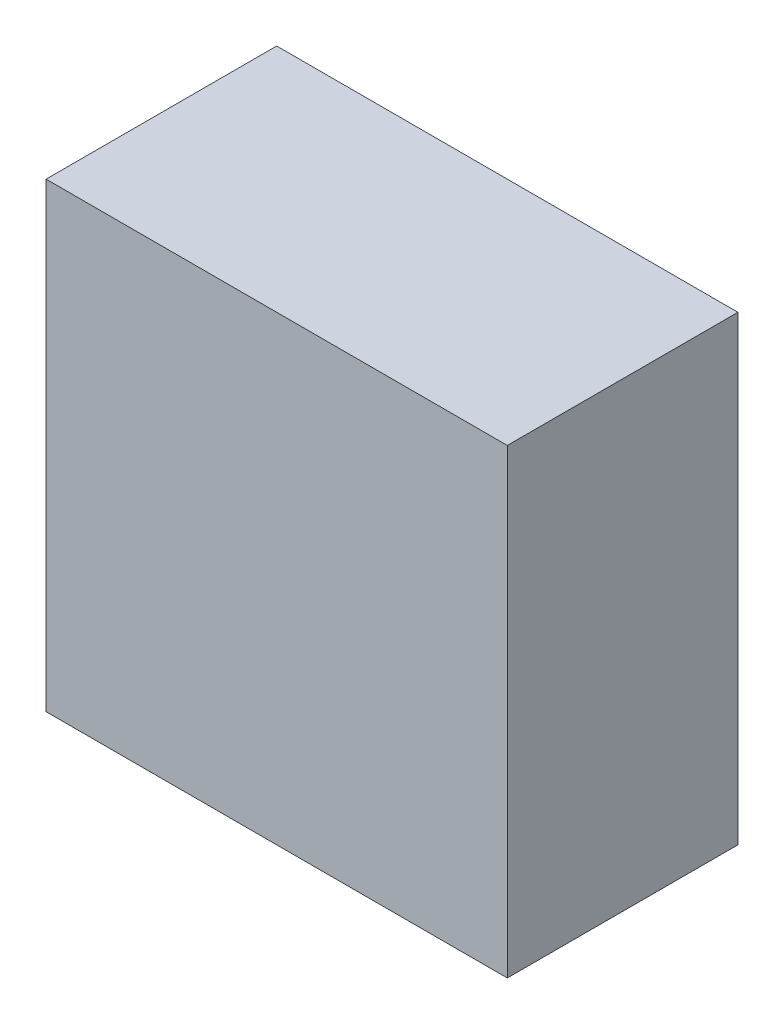
from build123d import *

# Parameters (mm, degrees)
SKETCH_1_W      = 40
SKETCH_1_H      = 20
EXTRUDE_1_DEPTH = 40


with BuildPart() as part:
    # 草图1 → 凸台-拉伸1 (new body)
    with BuildSketch(Plane(origin=(0, 0, 0), x_dir=(1, 0, 0), z_dir=(0, 1, 0))):
        Rectangle(SKETCH_1_W, SKETCH_1_H)
    extrude(amount=EXTRUDE_1_DEPTH)


solid = part.part
